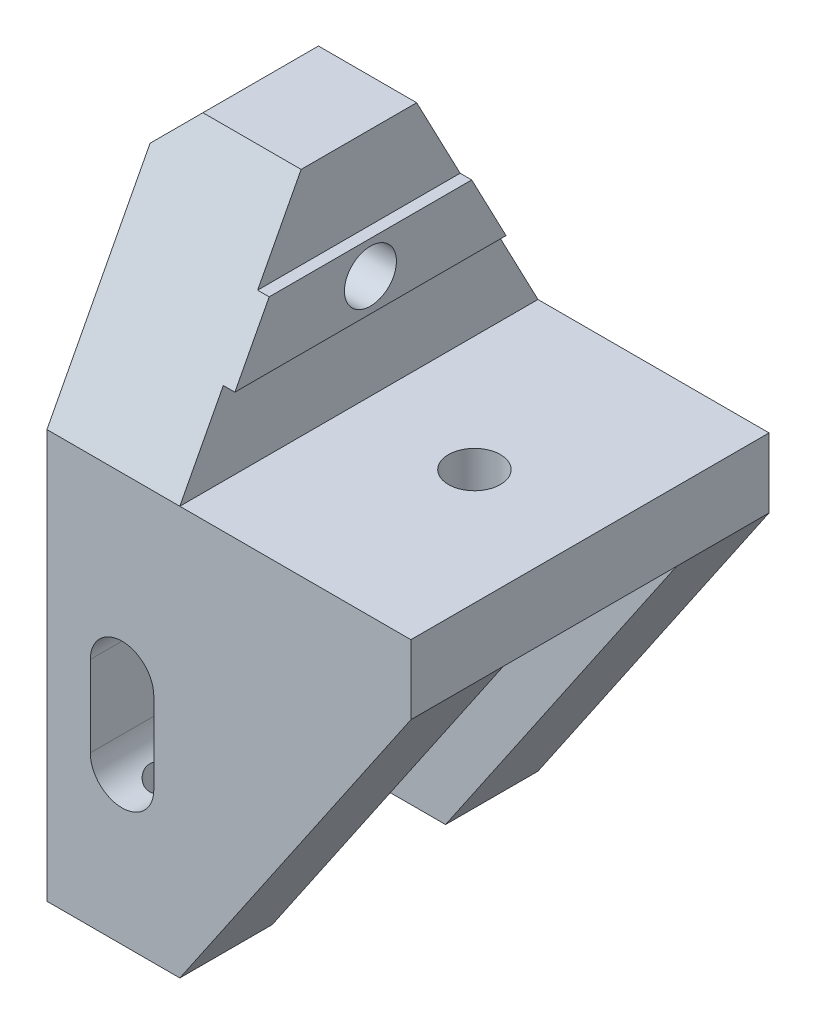
from build123d import *

# Parameters (mm, degrees)
RESSALTO_EXTRUS_O1_DEPTH   = 15
ESBO_O2_R                  = 2.25
CORTE_EXTRUS_O1_DEPTH      = 41.215045787
CORTE_EXTRUS_O2_DEPTH      = 46.367938746
CORTE_EXTRUS_O2_DEPTH_BACK = 46.367938746
ESBO_O3_R                  = 2.25
RESSALTO_EXTRUS_O2_DEPTH   = 8
CORTE_EXTRUS_O3_DEPTH      = 4
CORTE_EXTRUS_O4_REACH      = 69.72
CORTE_EXTRUS_O4_END_RADIUS = 2.75
ESBO_O6_R                  = 1.6
CORTE_EXTRUS_O5_DEPTH      = 3
ESBO_O8_R                  = 12.5
CORTE_EXTRUS_O6_DEPTH      = 15
CORTE_EXTRUS_O7_DEPTH      = 53.646110388
CORTE_EXTRUS_O7_DEPTH_BACK = 53.646110388
ESBO_O10_R                 = 5
CORTE_EXTRUS_O8_DEPTH      = 6
ESBO_O11_R                 = 5
CORTE_EXTRUS_O9_DEPTH      = 4


with BuildPart() as part:
    # Esboço1 → Ressalto-extrusão1 (new body)
    with BuildSketch(Plane.XY):
        Polygon((-28.499998137, 19.99999769), (-31.5, 16.99999769), (-31.5, -2.360471354), (-19.999999046, -9), (-3, -9), (0, -6), (0, 0), (-19.999999046, 0), (-19.999999046, 7.17), (-18.999999046, 7.17), (-18.999999046, 12.82999769), (-19.999999046, 12.82999769), (-19.999999046, 19.99999769), align=None)
    extrude(amount=RESSALTO_EXTRUS_O1_DEPTH)

    # Esboço2 → Corte-extrusão1 (cut, through all)
    with BuildSketch(Plane.ZY.offset(31.5)):
        with Locations((7.5, 9.99999769)):
            Circle(ESBO_O2_R)
    extrude(amount=-CORTE_EXTRUS_O1_DEPTH, mode=Mode.SUBTRACT)

    # Esboço3 → Corte-extrusão2 (cut, two sides: drawn at the far end of the back side and taken through both)
    with BuildSketch(Plane.XZ.offset(9).offset(-CORTE_EXTRUS_O2_DEPTH_BACK)):
        with Locations(Location((-9.999999046, 7.5, 0), (0, 0, 270))):
            Circle(ESBO_O3_R)
    extrude(amount=CORTE_EXTRUS_O2_DEPTH + CORTE_EXTRUS_O2_DEPTH_BACK, mode=Mode.SUBTRACT)

    # Esboço4 → Ressalto-extrusão2 (add)
    # profile 1 of 2: a face of its own
    with BuildSketch(Plane.XY.offset(15)):
        Polygon((-19.999999046, -9), (-31.5, -2.360471354), (-31.5, -35.360471354), (-19.999999046, -35.360471354), (0, -6), (-3, -9), align=None)
        with BuildLine():
            ThreePointArc((-22.25, -22.360471354), (-25, -25.110471354), (-27.75, -22.360471354))
            Line((-27.75, -22.360471354), (-27.75, -15.360471354))
            ThreePointArc((-27.75, -15.360471354), (-25, -12.610471354), (-22.25, -15.360471354))
            Line((-22.25, -15.360471354), (-22.25, -22.360471354))
        make_face(mode=Mode.SUBTRACT)
    # profile 2 of 2: a face of its own
    with BuildSketch(Plane.XY.offset(15)):
        Polygon((-31.5, 16.99999769), (-31.5, -2.360471354), (-19.999999046, -9), (-3, -9), (0, -6), (0, 0), (-19.999999046, 0), (-19.999999046, 7.17), (-18.999999046, 7.17), (-18.999999046, 12.82999769), (-19.999999046, 12.82999769), (-19.999999046, 19.99999769), (-28.499998137, 19.99999769), align=None)
    ressalto_extrus_o2 = extrude(amount=RESSALTO_EXTRUS_O2_DEPTH)

    # Espelhar1: Ressalto-extrusão2 across plane
    add(ressalto_extrus_o2.mirror(Plane.XY.offset(7.5)))

    # Esboço5 → Corte-extrusão3 (cut)
    with BuildSketch(Plane(origin=(0, 0, -8), x_dir=(-1, 0, 0), z_dir=(0, 0, -1))):
        Polygon((20.93, -17.9), (20.93, -24.710286949), (25, -27.060102545), (29.07, -24.710286949), (29.07, -17.9), (29.07, -13.010655758), (25, -10.660840163), (20.93, -13.010655758), align=None)
        with BuildLine():
            Line((22.25, -22.360471354), (22.25, -15.360471354))
            ThreePointArc((22.25, -15.360471354), (25, -12.610471354), (27.75, -15.360471354))
            Line((27.75, -15.360471354), (27.75, -22.360471354))
            ThreePointArc((27.75, -22.360471354), (25, -25.110471354), (22.25, -22.360471354))
        make_face(mode=Mode.SUBTRACT)
    extrude(amount=-CORTE_EXTRUS_O3_DEPTH, mode=Mode.SUBTRACT)

    # Corte-extrusão4: up to this cylinder (the profile starts outside it)
    corte_extrus_o4_end = Plane(origin=(-25, -22.360471354, 7.5), z_dir=(0, 0, -1)) * Cylinder(CORTE_EXTRUS_O4_END_RADIUS, 168.94, mode=Mode.PRIVATE)
    # Esboço6 → Corte-extrusão4 (cut, up to the surface)
    with BuildSketch(Plane.XZ.offset(35.360471354), mode=Mode.PRIVATE) as corte_extrus_o4_sk1:
        with Locations(Location((-25, 19, 0), (0, 0, 270))):
            Circle(ESBO_O6_R)
    corte_extrus_o4_tool1 = extrude(corte_extrus_o4_sk1.sketch, amount=-CORTE_EXTRUS_O4_REACH, mode=Mode.PRIVATE) - corte_extrus_o4_end
    add(corte_extrus_o4_tool1.solids().sort_by_distance((-25, -35.360471, 19))[0], mode=Mode.SUBTRACT)
    # Esboço6 → Corte-extrusão4 (cut, up to the surface)
    with BuildSketch(Plane.XZ.offset(35.360471354), mode=Mode.PRIVATE) as corte_extrus_o4_sk2:
        with Locations(Location((-25, -4, 0), (0, 0, 270))):
            Circle(ESBO_O6_R)
    corte_extrus_o4_tool2 = extrude(corte_extrus_o4_sk2.sketch, amount=-CORTE_EXTRUS_O4_REACH, mode=Mode.PRIVATE) - corte_extrus_o4_end
    add(corte_extrus_o4_tool2.solids().sort_by_distance((-25, -35.360471, -4))[0], mode=Mode.SUBTRACT)

    # Esboço7 → Corte-extrusão5 (cut)
    with BuildSketch(Plane(origin=(0, -32.360471354, 0), x_dir=(-1, 0, 0), z_dir=(0, -1, 0))):
        Polygon((26.674315781, -21.9), (33, -21.9), (33, -16.1), (26.674315781, -16.1), (23.325684219, -16.1), (21.651368439, -19), (23.325684219, -21.9), align=None)
        Polygon((26.674315781, 6.9), (23.325684219, 6.9), (21.651368439, 4), (23.325684219, 1.1), (26.674315781, 1.1), (33, 1.1), (33, 6.9), align=None)
    extrude(amount=-CORTE_EXTRUS_O5_DEPTH, mode=Mode.SUBTRACT)

    # Esboço8 → Corte-extrusão6 (cut)
    with BuildSketch(Plane.XY):
        with Locations((-25, -15.360471354)):
            Circle(ESBO_O8_R)
    extrude(amount=CORTE_EXTRUS_O6_DEPTH, mode=Mode.SUBTRACT)

    # Esboço9 → Corte-extrusão7 (cut, two sides: drawn at the far end of the back side and taken through both)
    with BuildSketch(Plane.ZY.offset(31.5).offset(-CORTE_EXTRUS_O7_DEPTH_BACK)):
        Polygon((-8, 0), (2.5, 19.99999769), (12.5, 19.99999769), (23, 0), (23, 29.458791051), (-8, 29.458791051), align=None)
    extrude(amount=CORTE_EXTRUS_O7_DEPTH + CORTE_EXTRUS_O7_DEPTH_BACK, mode=Mode.SUBTRACT)

    # Esboço10 → Corte-extrusão8 (cut)
    with BuildSketch(Plane.ZY.offset(31.5)):
        with Locations((7.5, 9.99999769)):
            Circle(ESBO_O10_R)
    extrude(amount=-CORTE_EXTRUS_O8_DEPTH, mode=Mode.SUBTRACT)

    # Esboço11 → Corte-extrusão9 (cut)
    with BuildSketch(Plane.XZ.offset(9)):
        with Locations((-9.999999046, 7.5)):
            Circle(ESBO_O11_R)
    extrude(amount=-CORTE_EXTRUS_O9_DEPTH, mode=Mode.SUBTRACT)


solid = part.part
